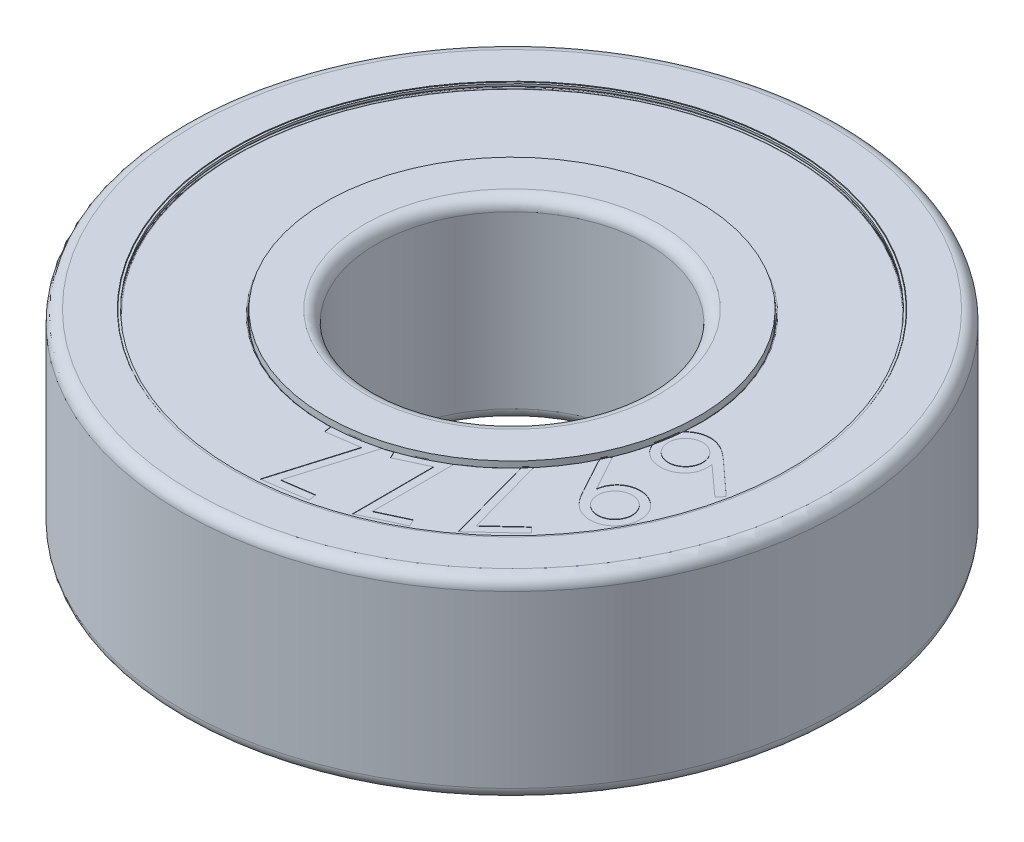
from build123d import *

# Parameters (mm, degrees)
CORTAR_EXTRUIR1_DEPTH = 0.01


with BuildPart() as part:
    # Croquis1 → Revolución1 (revolve)
    with BuildSketch(Plane(origin=(0, 0, 0), x_dir=(0, 0, -1), z_dir=(1, 0, 0)), mode=Mode.PRIVATE) as revoluci_n1_sk:
        with BuildLine():
            Line((7.388366168, 2.352454769), (7.2, 2.45))
            Line((7.2, 2.45), (7.2, 2.5))
            Line((7.2, 2.5), (8.2, 2.5))
            ThreePointArc((8.2, 2.5), (8.412132034, 2.412132034), (8.5, 2.2))
            Line((8.5, 2.2), (8.5, -2.2))
            ThreePointArc((8.5, -2.2), (8.412132034, -2.412132034), (8.2, -2.5))
            Line((8.2, -2.5), (7.2, -2.5))
            Line((7.2, -2.5), (7.2, -2.45))
            Line((7.2, -2.45), (7.388366168, -2.352454769))
            ThreePointArc((7.388366168, -2.352454769), (7.407008121, -2.320086184), (7.388366168, -2.287717599))
            Line((7.388366168, -2.287717599), (7.2, -2.178427283))
            Line((7.2, -2.178427283), (7.2, -0.9))
            ThreePointArc((7.2, -0.9), (7.5, 0), (7.2, 0.9))
            Line((7.2, 0.9), (7.2, 2.178427283))
            Line((7.2, 2.178427283), (7.388366168, 2.287717599))
            ThreePointArc((7.388366168, 2.287717599), (7.407008121, 2.320086184), (7.388366168, 2.352454769))
        make_face()
        with BuildLine():
            Line((4.8, -2.5), (3.8, -2.5))
            ThreePointArc((3.8, -2.5), (3.587867966, -2.412132034), (3.5, -2.2))
            Line((3.5, -2.2), (3.5, 2.2))
            ThreePointArc((3.5, 2.2), (3.587867966, 2.412132034), (3.8, 2.5))
            Line((3.8, 2.5), (4.8, 2.5))
            Line((4.8, 2.5), (4.8, 0.9))
            ThreePointArc((4.8, 0.9), (4.5, 0), (4.8, -0.9))
            Line((4.8, -0.9), (4.8, -2.5))
        make_face()
    revolve(revoluci_n1_sk.sketch.rotate(Axis((0, 5.680646404, 0), (0, -1, 0)), 180), axis=Axis((0, 5.680646404, 0), (0, -1, 0)))


with BuildPart() as body_2:
    # Croquis3 → Revolución3 (revolve)
    with BuildSketch(Plane(origin=(0, 0, 0), x_dir=(0, 0, -1), z_dir=(1, 0, 0))):
        with BuildLine():
            Line((6, 1.475), (6, -1.475))
            ThreePointArc((6, -1.475), (7.475, 0), (6, 1.475))
        make_face()
    revolve(axis=Axis((0, 2.5, -6), (0, -1, 0)))


with BuildPart() as body_3:
    # Croquis4 → Revolución4 (revolve)
    with BuildSketch(Plane(origin=(0, 0, 0), x_dir=(0, 0, -1), z_dir=(1, 0, 0)), mode=Mode.PRIVATE) as revoluci_n4_sk:
        with BuildLine():
            Line((7.190891401, -2.486578606), (7.190891401, -2.468145024))
            ThreePointArc((7.190891401, -2.468145024), (7.195221521, -2.452619005), (7.206961886, -2.441574954))
            Line((7.206961886, -2.441574954), (7.386962265, -2.347208701))
            ThreePointArc((7.386962265, -2.347208701), (7.403025194, -2.321311921), (7.388140555, -2.29472041))
            Line((7.388140555, -2.29472041), (7.220891401, -2.197230403))
            ThreePointArc((7.220891401, -2.197230403), (7.198139477, -2.194138843), (7.179865374, -2.20804082))
            Line((7.179865374, -2.20804082), (7.121651721, -2.307909357))
            ThreePointArc((7.121651721, -2.307909357), (7.110679499, -2.318813416), (7.095733499, -2.322801552))
            Line((7.095733499, -2.322801552), (4.886761866, -2.322801552))
            ThreePointArc((4.886761866, -2.322801552), (4.868740588, -2.316785579), (4.857947012, -2.301150455))
            Line((4.857947012, -2.301150455), (4.849632829, -2.272455436))
            Line((4.849632829, -2.272455436), (4.801608073, -2.286370276))
            Line((4.801608073, -2.286370276), (4.820377679, -2.351150455))
            ThreePointArc((4.820377679, -2.351150455), (4.831171256, -2.366785579), (4.849192533, -2.372801552))
            Line((4.849192533, -2.372801552), (7.124462698, -2.372801552))
            ThreePointArc((7.124462698, -2.372801552), (7.139408698, -2.368813416), (7.150380919, -2.357909357))
            Line((7.150380919, -2.357909357), (7.197138826, -2.277693747))
            ThreePointArc((7.197138826, -2.277693747), (7.215412929, -2.26379177), (7.238164853, -2.26688333))
            Line((7.238164853, -2.26688333), (7.283332922, -2.293211925))
            ThreePointArc((7.283332922, -2.293211925), (7.298217561, -2.319803437), (7.282154632, -2.345700217))
            Line((7.282154632, -2.345700217), (7.156961886, -2.411333247))
            ThreePointArc((7.156961886, -2.411333247), (7.145221521, -2.422377298), (7.140891401, -2.437903317))
            Line((7.140891401, -2.437903317), (7.140891401, -2.486578606))
            Line((7.140891401, -2.486578606), (7.190891401, -2.486578606))
        make_face()
        with BuildLine():
            Line((5.055155191, -1.210747188), (5.055155191, -1.321802306))
            ThreePointArc((5.055155191, -1.321802306), (5.058582699, -1.335727199), (5.068082034, -1.346470247))
            ThreePointArc((5.068082034, -1.346470247), (5.940462369, -1.636431633), (6.831607434, -1.410631878))
            ThreePointArc((6.831607434, -1.410631878), (6.842420645, -1.399670291), (6.846372011, -1.384788467))
            Line((6.846372011, -1.384788467), (6.846372011, -1.279213242))
            ThreePointArc((6.846372011, -1.279213242), (6.83079127, -1.252905734), (6.800233013, -1.253924257))
            ThreePointArc((6.800233013, -1.253924257), (5.941217827, -1.486352439), (5.103240914, -1.18681172))
            ThreePointArc((5.103240914, -1.18681172), (5.07178679, -1.183890423), (5.055155191, -1.210747188))
        make_face()
        with BuildLine():
            Line((6.846372011, 1.279213242), (6.846372011, 1.384788467))
            ThreePointArc((6.846372011, 1.384788467), (6.842420645, 1.399670291), (6.831607434, 1.410631878))
            ThreePointArc((6.831607434, 1.410631878), (5.940462369, 1.636431633), (5.068082034, 1.346470247))
            ThreePointArc((5.068082034, 1.346470247), (5.058582699, 1.335727199), (5.055155191, 1.321802306))
            Line((5.055155191, 1.321802306), (5.055155191, 1.210747188))
            ThreePointArc((5.055155191, 1.210747188), (5.07178679, 1.183890423), (5.103240914, 1.18681172))
            ThreePointArc((5.103240914, 1.18681172), (5.941217827, 1.486352439), (6.800233013, 1.253924257))
            ThreePointArc((6.800233013, 1.253924257), (6.83079127, 1.252905734), (6.846372011, 1.279213242))
        make_face()
        with BuildLine():
            Line((7.140891401, 2.486578606), (7.190891401, 2.486578606))
            Line((7.190891401, 2.486578606), (7.190891401, 2.468145024))
            ThreePointArc((7.190891401, 2.468145024), (7.195221521, 2.452619005), (7.206961886, 2.441574954))
            Line((7.206961886, 2.441574954), (7.386962265, 2.347208701))
            ThreePointArc((7.386962265, 2.347208701), (7.403025194, 2.321311921), (7.388140555, 2.29472041))
            Line((7.388140555, 2.29472041), (7.220891401, 2.197230403))
            ThreePointArc((7.220891401, 2.197230403), (7.198139477, 2.194138843), (7.179865374, 2.20804082))
            Line((7.179865374, 2.20804082), (7.121651721, 2.307909357))
            ThreePointArc((7.121651721, 2.307909357), (7.110679499, 2.318813416), (7.095733499, 2.322801552))
            Line((7.095733499, 2.322801552), (4.886761866, 2.322801552))
            ThreePointArc((4.886761866, 2.322801552), (4.868740588, 2.316785579), (4.857947012, 2.301150455))
            Line((4.857947012, 2.301150455), (4.849632829, 2.272455436))
            Line((4.849632829, 2.272455436), (4.801608073, 2.286370276))
            Line((4.801608073, 2.286370276), (4.820377679, 2.351150455))
            ThreePointArc((4.820377679, 2.351150455), (4.831171256, 2.366785579), (4.849192533, 2.372801552))
            Line((4.849192533, 2.372801552), (7.124462698, 2.372801552))
            ThreePointArc((7.124462698, 2.372801552), (7.139408698, 2.368813416), (7.150380919, 2.357909357))
            Line((7.150380919, 2.357909357), (7.197138826, 2.277693747))
            ThreePointArc((7.197138826, 2.277693747), (7.215412929, 2.26379177), (7.238164853, 2.26688333))
            Line((7.238164853, 2.26688333), (7.283332922, 2.293211925))
            ThreePointArc((7.283332922, 2.293211925), (7.298217561, 2.319803437), (7.282154632, 2.345700217))
            Line((7.282154632, 2.345700217), (7.156961886, 2.411333247))
            ThreePointArc((7.156961886, 2.411333247), (7.145221521, 2.422377298), (7.140891401, 2.437903317))
            Line((7.140891401, 2.437903317), (7.140891401, 2.486578606))
        make_face()
    revolve(revoluci_n4_sk.sketch.rotate(Axis((0, 1.518567524, 0), (0, -1, 0)), 180), axis=Axis((0, 1.518567524, 0), (0, -1, 0)))


with BuildPart() as cortar_extruir1_tool:
    # Croquis6 → Cortar-Extruir1 (new body)
    # profile 1 of 5: a face of its own
    with BuildSketch(Plane(origin=(0, 2.372801552, 0), x_dir=(1, 0, 0), z_dir=(0, 1, 0))):
        Polygon((1.491627701, -6.555493634), (1.521308524, -6.756899216), (0.420998027, -6.917175658), (1.018430586, -4.906935942), (0.190335634, -5.027779291), (0.160654811, -4.825101673), (1.310574683, -4.65719302), (0.707629972, -6.669552795), align=None)
    # profile 2 of 5: a face of its own
    with BuildSketch(Plane(origin=(0, 2.372801552, 0), x_dir=(1, 0, 0), z_dir=(0, 1, 0))):
        Polygon((3.310030634, -5.851219459), (3.39610502, -6.035664571), (2.388653097, -6.505469593), (2.383140944, -4.408731478), (1.625007931, -4.762357279), (1.538509534, -4.576640132), (2.591330714, -4.085634523), (2.592178738, -6.186188743), align=None)
    # profile 3 of 5: a face of its own
    with BuildSketch(Plane(origin=(0, 2.372801552, 0), x_dir=(1, 0, 0), z_dir=(0, 1, 0))):
        Polygon((5.126882642, -4.631465342), (4.150383577, -5.538850491), (3.507157749, -3.194913525), (3.694146932, -3.142336068), (4.253418433, -5.171232302), (4.991198882, -4.485605299), align=None)
    # profile 4 of 5: a face of its own
    with BuildSketch(Plane(origin=(0, 2.372801552, 0), x_dir=(1, 0, 0), z_dir=(0, 1, 0))):
        with BuildLine():
            Line((4.296339957, -1.987812188), (4.476968964, -1.88647338))
            Line((4.476968964, -1.88647338), (4.976454808, -2.795130564))
            add(Edge.make_bspline(
                [(4.976454808, -2.795130564), (4.980093779, -2.775832617), (4.987192235, -2.73818856), (5.00294055, -2.684233278), (5.020415246, -2.633438599), (5.036175945, -2.602197415), (5.043872676, -2.586940794)],
                knots=[0, 0, 0, 0, 1.071898395, 2.09092729, 3.06770507, 4, 4, 4, 4], degree=3))
            add(Edge.make_bspline(
                [(5.043872676, -2.586940794), (5.053961467, -2.568899854), (5.073786304, -2.533448756), (5.109496794, -2.484934471), (5.148571981, -2.440783618), (5.192052975, -2.40186151), (5.239026323, -2.367091876), (5.290143706, -2.337230121), (5.345489848, -2.312904488), (5.403737024, -2.292928367), (5.463822589, -2.278702892), (5.524426934, -2.270097853), (5.584945363, -2.267404995), (5.645180214, -2.271335857), (5.705091977, -2.281218884), (5.764749265, -2.297008668), (5.824265019, -2.319017868), (5.862659825, -2.338109698), (5.88214391, -2.347798166)],
                knots=[0, 0, 0, 0, 1.02051594, 2.005350567, 2.969867855, 3.929187739, 4.883230781, 5.853470762, 6.847646364, 7.865793709, 8.892337895, 9.893845635, 10.886450037, 11.880159448, 12.871017886, 13.882339694, 14.925357903, 16, 16, 16, 16], degree=3))
            add(Edge.make_bspline(
                [(5.88214391, -2.347798166), (5.908004331, -2.362554235), (5.95879627, -2.391536338), (6.026821052, -2.445590611), (6.085405276, -2.507353731), (6.135060189, -2.575620268), (6.175188923, -2.649691643), (6.204719526, -2.728721779), (6.222937026, -2.812394868), (6.230239775, -2.899149275), (6.227611834, -2.986783177), (6.213272187, -3.072933477), (6.188686552, -3.156779194), (6.163310045, -3.209270743), (6.150543349, -3.235678775)],
                knots=[0, 0, 0, 0, 1.036390773, 2.035554555, 3.014460263, 3.99466602, 4.968690428, 5.941144652, 6.924611512, 7.943047356, 8.96804758, 9.97124532, 10.979351533, 12, 12, 12, 12], degree=3))
            add(Edge.make_bspline(
                [(6.150543349, -3.235678775), (6.136205028, -3.260692695), (6.107897713, -3.310076223), (6.054487816, -3.376345929), (5.993282998, -3.43441421), (5.925099136, -3.484388362), (5.851295687, -3.525206395), (5.772538044, -3.554732852), (5.69024994, -3.573497058), (5.605260065, -3.580927149), (5.5198824, -3.577638754), (5.436244293, -3.563293064), (5.354688214, -3.539718785), (5.303906096, -3.514881137), (5.278351175, -3.502382167)],
                knots=[0, 0, 0, 0, 1.021124785, 2.015947313, 3.004996392, 4.00540842, 5.005770232, 5.985954457, 6.978046381, 7.989445417, 9.002618589, 9.998753181, 10.992919027, 12, 12, 12, 12], degree=3))
            add(Edge.make_bspline(
                [(5.278351175, -3.502382167), (5.259196339, -3.491417765), (5.220180095, -3.469084513), (5.164731161, -3.428492724), (5.111026873, -3.381352184), (5.058061605, -3.327232752), (5.005570712, -3.26304316), (4.952390464, -3.187167123), (4.897379933, -3.098878483), (4.861952248, -3.03487174), (4.843315117, -3.001200276)],
                knots=[0, 0, 0, 0, 0.785893051, 1.600775657, 2.443049426, 3.329748662, 4.29560727, 5.393807143, 6.628983065, 8, 8, 8, 8], degree=3))
            Line((4.843315117, -3.001200276), (4.296339957, -1.987812188))
        make_face()
        with BuildLine():
            add(Edge.make_bspline(
                [(5.18506859, -2.71668839), (5.178266927, -2.73026652), (5.164872178, -2.7570064), (5.150186984, -2.79893116), (5.139469142, -2.841064243), (5.132940449, -2.883666111), (5.131372464, -2.926601983), (5.134000012, -2.969895321), (5.140662886, -3.013550532), (5.152232875, -3.056913602), (5.167372163, -3.099058422), (5.185868452, -3.139177043), (5.208559205, -3.17604055), (5.23417631, -3.210311946), (5.263037689, -3.241849498), (5.295630124, -3.270285281), (5.331197503, -3.296471199), (5.35718907, -3.310998539), (5.370361725, -3.318361067)],
                knots=[0, 0, 0, 0, 1.03983913, 2.047791165, 3.03680997, 4.016248868, 4.995304535, 5.975317996, 6.984944062, 8.016312687, 9.04576926, 10.051065045, 11.037804564, 12.006407295, 12.979840992, 13.961193793, 14.966722863, 16, 16, 16, 16], degree=3))
            add(Edge.make_bspline(
                [(5.370361725, -3.318361067), (5.383807333, -3.325007408), (5.410449848, -3.338177154), (5.452060724, -3.352693521), (5.493973346, -3.363795637), (5.536406728, -3.369265261), (5.579142233, -3.371980652), (5.622145111, -3.368401443), (5.665664424, -3.361927515), (5.708881217, -3.350321612), (5.7510724, -3.335271742), (5.791065669, -3.316477586), (5.828656341, -3.29470684), (5.862548804, -3.268318054), (5.894415048, -3.239437882), (5.92297878, -3.206676238), (5.949413851, -3.170888806), (5.963844018, -3.144698196), (5.971186378, -3.131371884)],
                knots=[0, 0, 0, 0, 1.02763198, 2.036256018, 3.016539594, 3.995240636, 4.965699939, 5.946989254, 6.947711927, 7.979768166, 9.009911079, 10.015877095, 11.006598895, 11.981693715, 12.955776402, 13.951464019, 14.957663476, 16, 16, 16, 16], degree=3))
            add(Edge.make_bspline(
                [(5.971186378, -3.131371884), (5.978005759, -3.117941835), (5.991491456, -3.091383184), (6.005935206, -3.049662255), (6.016995712, -3.00776232), (6.022717649, -2.965335451), (6.024466302, -2.922602181), (6.021959443, -2.87938965), (6.014599732, -2.835827945), (6.003208109, -2.792415764), (5.988049725, -2.750261108), (5.969479607, -2.710273719), (5.94720289, -2.673127358), (5.921777694, -2.638638249), (5.892763233, -2.607094404), (5.860337907, -2.578575364), (5.824491189, -2.552917455), (5.798618266, -2.538366349), (5.785469231, -2.530971243)],
                knots=[0, 0, 0, 0, 1.033069308, 2.04295066, 3.024456222, 4.004377278, 4.975610062, 5.957499363, 6.970592977, 8.00393574, 9.035362792, 10.04258281, 11.026197078, 12.004434791, 12.979731734, 13.962962937, 14.964745071, 16, 16, 16, 16], degree=3))
            add(Edge.make_bspline(
                [(5.785469231, -2.530971243), (5.772039182, -2.524151862), (5.745480531, -2.510666165), (5.703759602, -2.496222415), (5.661859665, -2.485161907), (5.619432803, -2.47943998), (5.576699506, -2.47769129), (5.533487081, -2.480198289), (5.489924965, -2.487557455), (5.446514358, -2.498951165), (5.404353858, -2.514101805), (5.364387608, -2.532699932), (5.327262219, -2.554817072), (5.29313601, -2.580533122), (5.261575207, -2.609356196), (5.233145736, -2.64195903), (5.206958103, -2.677523584), (5.192430998, -2.703515538), (5.18506859, -2.71668839)],
                knots=[0, 0, 0, 0, 1.033205521, 2.043220029, 3.024855006, 4.004905266, 4.976266111, 5.958284876, 6.971512069, 8.004991082, 9.03655413, 10.043906953, 11.027650913, 11.998235601, 12.973661139, 13.957021985, 14.964608569, 16, 16, 16, 16], degree=3))
        make_face(mode=Mode.SUBTRACT)
    # profile 5 of 5: a face of its own
    with BuildSketch(Plane(origin=(0, 2.372801552, 0), x_dir=(1, 0, 0), z_dir=(0, 1, 0))):
        with BuildLine():
            Line((6.82511706, -1.299135033), (6.687313241, -1.453899323))
            Line((6.687313241, -1.453899323), (5.919003946, -0.761488132))
            add(Edge.make_bspline(
                [(5.919003946, -0.761488132), (5.922146631, -0.780954283), (5.928271188, -0.818890496), (5.931966793, -0.875058834), (5.931433572, -0.928701499), (5.927357425, -0.963339595), (5.925364122, -0.980278196)],
                knots=[0, 0, 0, 0, 1.076017042, 2.096973924, 3.069388797, 4, 4, 4, 4], degree=3))
            add(Edge.make_bspline(
                [(5.925364122, -0.980278196), (5.921840033, -1.000447924), (5.914880621, -1.040279338), (5.897020402, -1.09768286), (5.874772403, -1.152287998), (5.846543503, -1.203374501), (5.813160223, -1.251140091), (5.774927842, -1.296014021), (5.730803826, -1.337089367), (5.682547152, -1.375021522), (5.630630575, -1.408187966), (5.576699426, -1.436699895), (5.520322102, -1.458136916), (5.462425121, -1.474364838), (5.402800851, -1.485093454), (5.341446801, -1.489623454), (5.278233827, -1.488532676), (5.235885212, -1.483005657), (5.214296414, -1.480188052)],
                knots=[0, 0, 0, 0, 1.013792182, 2.002048626, 2.972444825, 3.931730075, 4.887736409, 5.856412046, 6.847444775, 7.870318859, 8.894271607, 9.896797594, 10.888003583, 11.877103652, 12.873247186, 13.884834969, 14.921715152, 16, 16, 16, 16], degree=3))
            add(Edge.make_bspline(
                [(5.214296414, -1.480188052), (5.185153101, -1.47467151), (5.127789651, -1.463813174), (5.045738353, -1.435640196), (4.969920633, -1.396901745), (4.900234649, -1.349133519), (4.838315824, -1.292166822), (4.784546172, -1.227350739), (4.73993518, -1.154765033), (4.704536265, -1.075466101), (4.678686179, -0.991911259), (4.664326764, -0.905678824), (4.660247678, -0.818218482), (4.667209541, -0.760172829), (4.670713347, -0.730959286)],
                knots=[0, 0, 0, 0, 1.033506883, 2.034275287, 3.013060665, 3.994770906, 4.971605657, 5.937861606, 6.922784096, 7.933277429, 8.95924549, 9.964096529, 10.975359011, 12, 12, 12, 12], degree=3))
            add(Edge.make_bspline(
                [(4.670713347, -0.730959286), (4.67588348, -0.702923803), (4.686119413, -0.647418592), (4.714794209, -0.568076174), (4.752991687, -0.493544545), (4.800139847, -0.424051066), (4.856582836, -0.361965771), (4.92021892, -0.307617759), (4.991822895, -0.26355228), (5.069158735, -0.228410393), (5.150752838, -0.203581635), (5.234454335, -0.18899237), (5.319525444, -0.185086613), (5.375887067, -0.191686653), (5.404253679, -0.195008431)],
                knots=[0, 0, 0, 0, 1.013223235, 2.005999671, 2.989107619, 3.988083569, 4.985259538, 5.966822001, 6.956445765, 7.967231215, 8.982412925, 9.983059193, 10.984880603, 12, 12, 12, 12], degree=3))
            add(Edge.make_bspline(
                [(5.404253679, -0.195008431), (5.425707742, -0.198775126), (5.469466631, -0.206457885), (5.534346039, -0.227274978), (5.600354211, -0.253355219), (5.655184639, -0.281283273), (5.699816103, -0.307709121), (5.735508284, -0.330038649), (5.772225537, -0.355638076), (5.810542589, -0.383586571), (5.849985474, -0.414745071), (5.890951213, -0.448567744), (5.933533978, -0.485147713), (5.962024286, -0.510836431), (5.976669544, -0.52404155)],
                knots=[0, 0, 0, 0, 1.168820402, 2.383990459, 3.651423841, 4.97900746, 5.68344226, 6.43751457, 7.239878865, 8.087211139, 8.98481966, 9.93940915, 10.940766634, 12, 12, 12, 12], degree=3))
            Line((5.976669544, -0.52404155), (6.82511706, -1.299135033))
        make_face()
        with BuildLine():
            add(Edge.make_bspline(
                [(5.749823257, -0.903108057), (5.75167684, -0.888149346), (5.755322012, -0.858732242), (5.755585596, -0.814685376), (5.751883958, -0.771778481), (5.743674817, -0.729893171), (5.731547185, -0.688963754), (5.714128789, -0.64946703), (5.693489111, -0.610673701), (5.668428038, -0.573617624), (5.640407171, -0.538805155), (5.609769732, -0.507086702), (5.576555774, -0.479507659), (5.541221616, -0.455569414), (5.50349037, -0.43557535), (5.463596542, -0.418800311), (5.420955937, -0.406634272), (5.391584438, -0.401259243), (5.376692915, -0.398534072)],
                knots=[0, 0, 0, 0, 1.035954112, 2.037259141, 3.02296538, 3.993357715, 4.96821924, 5.9523424, 6.957039138, 7.986955317, 9.023866768, 10.027528367, 11.014527964, 11.987837316, 12.957645194, 13.94693992, 14.95908642, 16, 16, 16, 16], degree=3))
            add(Edge.make_bspline(
                [(5.376692915, -0.398534072), (5.36173531, -0.39668537), (5.332320381, -0.3930498), (5.288257702, -0.392716414), (5.245435394, -0.396673687), (5.203319773, -0.403933955), (5.162646129, -0.417189102), (5.122600078, -0.433528822), (5.083860609, -0.454510805), (5.046771608, -0.479487186), (5.011966833, -0.507530482), (4.980250709, -0.538163725), (4.952655357, -0.57137289), (4.928778959, -0.606729873), (4.908578843, -0.644327197), (4.892737025, -0.684410792), (4.879520612, -0.726402553), (4.874605409, -0.755614684), (4.87211893, -0.770392378)],
                knots=[0, 0, 0, 0, 1.036953971, 2.039225419, 3.02588302, 3.99540699, 4.974067527, 5.964317079, 6.969983509, 8.00089372, 9.038805954, 10.043436245, 11.031388453, 12.005637203, 12.976381099, 13.962942736, 14.969503154, 16, 16, 16, 16], degree=3))
            add(Edge.make_bspline(
                [(4.87211893, -0.770392378), (4.870265568, -0.785350995), (4.866620834, -0.814767914), (4.866354072, -0.858816126), (4.870067457, -0.901718045), (4.878233425, -0.943621642), (4.890506979, -0.984429493), (4.907280772, -1.024138612), (4.928061085, -1.062816361), (4.953102284, -1.099865206), (4.980967178, -1.134696723), (5.011899426, -1.165982299), (5.044943016, -1.193588229), (5.080302289, -1.217499875), (5.118024022, -1.237510422), (5.157805882, -1.25419242), (5.200128991, -1.26645472), (5.229224942, -1.27182135), (5.243977236, -1.274542352)],
                knots=[0, 0, 0, 0, 1.037874662, 2.041036005, 3.02856964, 4.00076098, 4.977429796, 5.95957019, 6.96612953, 7.997955065, 9.03678884, 10.035354045, 11.024183436, 11.999297201, 12.970903, 13.962031775, 14.966704758, 16, 16, 16, 16], degree=3))
            add(Edge.make_bspline(
                [(5.243977236, -1.274542352), (5.258937159, -1.27640966), (5.288497017, -1.280099342), (5.332799217, -1.280141281), (5.376035388, -1.277198388), (5.418057539, -1.268824791), (5.45896385, -1.256493485), (5.498903499, -1.239917396), (5.537661549, -1.219004636), (5.574745723, -1.194009243), (5.609550654, -1.165970649), (5.641270874, -1.135337751), (5.668850142, -1.102122818), (5.692785815, -1.066788163), (5.712789951, -1.029059861), (5.7294737, -0.989279796), (5.741735527, -0.946956202), (5.747102223, -0.917860318), (5.749823257, -0.903108057)],
                knots=[0, 0, 0, 0, 1.035636643, 2.04635234, 3.040629476, 4.010724433, 4.985287212, 5.974278769, 6.978667618, 8.008268178, 9.044861867, 10.048215894, 11.034913025, 12.007924106, 12.977434786, 13.966426342, 14.968932902, 16, 16, 16, 16], degree=3))
        make_face(mode=Mode.SUBTRACT)
    extrude(amount=-CORTAR_EXTRUIR1_DEPTH)


with BuildPart() as part_1:
    add(part.part)

    # Cortar-Extruir1: cut by cortar_extruir1_tool
    add(cortar_extruir1_tool.part, mode=Mode.SUBTRACT)


with BuildPart() as body_3_1:
    add(body_3.part)

    # Cortar-Extruir1: cut by cortar_extruir1_tool
    add(cortar_extruir1_tool.part, mode=Mode.SUBTRACT)


solid = Compound([body_2.part, part_1.part, body_3_1.part])
